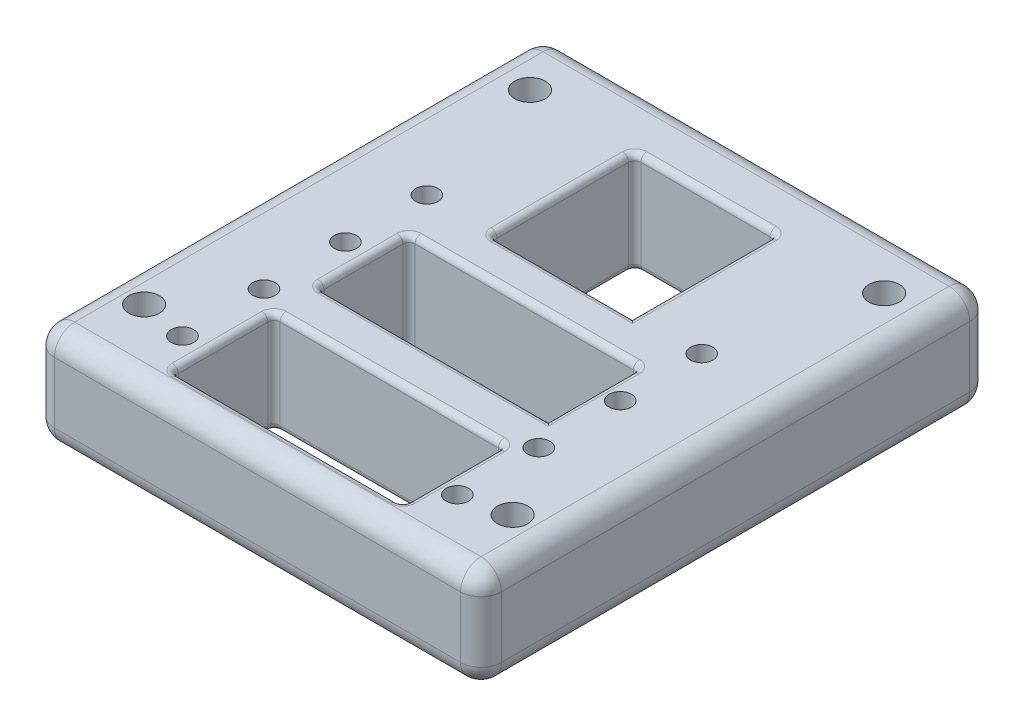
from build123d import *

# Parameters (mm, degrees)
SKETCH1_W               = 43.9
SKETCH1_H               = 50
BOSS_EXTRUDE1_DEPTH     = 10
SKETCH2_W               = 13.9
SKETCH2_H               = 14.124937778
SKETCH2_W_2             = 22.645487531
SKETCH2_H_2             = 8.960003197
SKETCH2_H_3             = 10.00329124
CUT_EXTRUDE1_DEPTH      = 10
SKETCH6_R               = 1.1
CUT_EXTRUDE2_DEPTH      = 10
CUT_EXTRUDE3_DEPTH      = 30
CUT_EXTRUDE3_DEPTH_BACK = 30
SKETCH7_R               = 1.5
FILLET1_R               = 2
FILLET2_R               = 0.6


with BuildPart() as part:
    # Sketch1 → Boss-Extrude1 (new body)
    with BuildSketch(Plane(origin=(0, 0, 0), x_dir=(1, 0, 0), z_dir=(0, 1, 0))):
        with Locations((21.95, 25)):
            Rectangle(SKETCH1_W, SKETCH1_H)
    extrude(amount=BOSS_EXTRUDE1_DEPTH)

    # Sketch2 → Cut-Extrude1 (cut)
    with BuildSketch(Plane.XZ):
        with Locations((21.95, -36.937531111)):
            Rectangle(SKETCH2_W, SKETCH2_H)
        with Locations((22.194315827, -21.478034433)):
            Rectangle(SKETCH2_W_2, SKETCH2_H_2)
        with Locations((22.194315827, -7.700495272)):
            Rectangle(SKETCH2_W_2, SKETCH2_H_3)
    extrude(amount=-CUT_EXTRUDE1_DEPTH, mode=Mode.SUBTRACT)

    # Sketch6 → Cut-Extrude2 (cut)
    with BuildSketch(Plane(origin=(0, 10, 0), x_dir=(1, 0, 0), z_dir=(0, 1, 0))):
        with Locations((8.47269685, 30.110580354)):
            Circle(SKETCH6_R)
        with Locations((8.47269685, 22.110580354)):
            Circle(SKETCH6_R)
        with Locations((8.47269685, 14.110580354)):
            Circle(SKETCH6_R)
        with Locations((8.47269685, 6.110580354)):
            Circle(SKETCH6_R)
        with Locations((35.47269685, 6.110580354)):
            Circle(SKETCH6_R)
        with Locations((35.47269685, 14.110580354)):
            Circle(SKETCH6_R)
        with Locations((35.47269685, 22.110580354)):
            Circle(SKETCH6_R)
        with Locations((35.47269685, 30.110580354)):
            Circle(SKETCH6_R)
    extrude(amount=-CUT_EXTRUDE2_DEPTH, mode=Mode.SUBTRACT)

    # Sketch7 → Cut-Extrude3 (cut, two sides: drawn at the far end of the back side and taken through both)
    with BuildSketch(Plane.XZ.offset(-CUT_EXTRUDE3_DEPTH_BACK)):
        with Locations((4.60534828, -44.110580354)):
            Circle(SKETCH7_R)
        with Locations((39.293747868, -44.208761067)):
            Circle(SKETCH7_R)
        with Locations((39.90534828, -7.110580354)):
            Circle(SKETCH7_R)
        with Locations((3.90534828, -6.908780227)):
            Circle(SKETCH7_R)
    extrude(amount=CUT_EXTRUDE3_DEPTH + CUT_EXTRUDE3_DEPTH_BACK, mode=Mode.SUBTRACT)

    # Fillet1
    fillet1_edges = [part.edges().sort_by_distance(p)[0] for p in [
        (21.95, 10, -50),
        (21.95, 0, -50),
        (43.9, 10, -25),
        (43.9, 5, -50),
        (43.9, 0, -25),
        (21.95, 10, 0),
        (43.9, 5, 0),
        (21.95, 0, 0),
        (0, 5, -50),
        (0, 10, -25),
        (0, 5, 0),
        (0, 0, -25),
    ]]
    fillet(fillet1_edges, radius=FILLET1_R)

    # Fillet2
    fillet2_edges = [part.edges().sort_by_distance(p)[0] for p in [
        (28.9, 10, -36.937531111),
        (28.9, 0, -36.937531111),
        (21.95, 10, -29.875062222),
        (21.95, 0, -29.875062222),
        (33.517059593, 10, -21.478034433),
        (33.517059593, 0, -21.478034433),
        (22.194315827, 10, -16.998032835),
        (22.194315827, 0, -16.998032835),
        (33.517059593, 10, -7.700495272),
        (33.517059593, 0, -7.700495272),
        (21.95, 10, -44),
        (28.9, 5, -44),
        (21.95, 0, -44),
        (15, 5, -29.875062222),
        (15, 10, -36.937531111),
        (15, 5, -44),
        (15, 0, -36.937531111),
        (22.194315827, 10, -25.958036032),
        (33.517059593, 5, -25.958036032),
        (22.194315827, 0, -25.958036032),
        (10.871572062, 5, -16.998032835),
        (10.871572062, 10, -21.478034433),
        (10.871572062, 5, -25.958036032),
        (10.871572062, 0, -21.478034433),
        (22.194315827, 10, -12.702140892),
        (33.517059593, 5, -12.702140892),
        (22.194315827, 0, -12.702140892),
        (10.871572062, 10, -7.700495272),
        (10.871572062, 5, -12.702140892),
        (10.871572062, 0, -7.700495272),
        (33.517059593, 5, -2.698849652),
        (22.194315827, 10, -2.698849652),
        (10.871572062, 5, -2.698849652),
        (22.194315827, 0, -2.698849652),
    ]]
    fillet(fillet2_edges, radius=FILLET2_R)


solid = part.part
